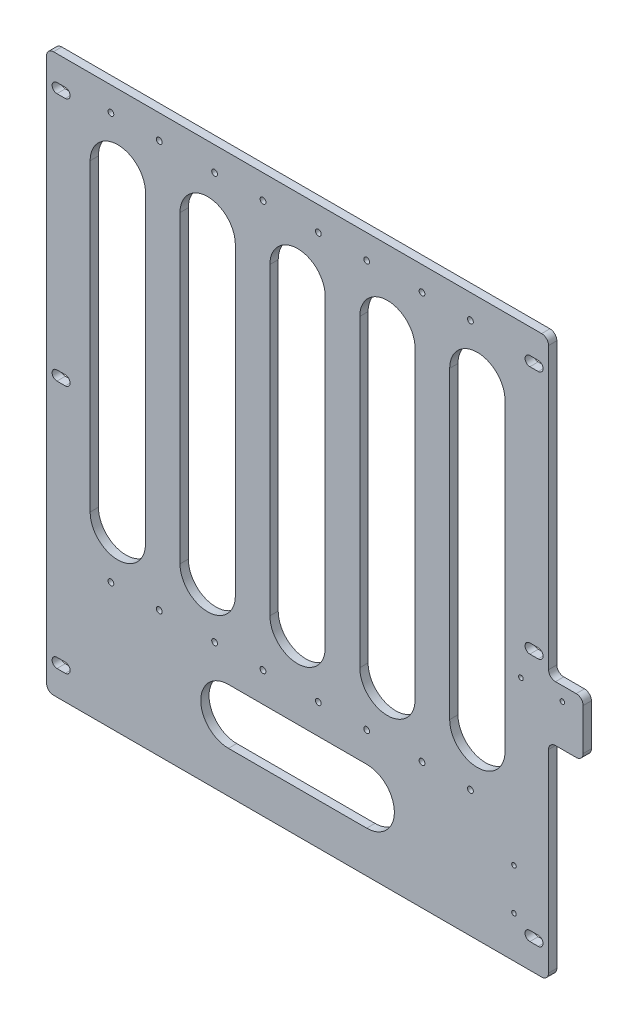
from build123d import *

# Parameters (mm, degrees)
SKETCH_1_W             = 363
SKETCH_1_H             = 403
EXTRUDE_1_DEPTH        = 6
FILLET_1_R             = 5
SKETCH_3_R             = 3.5
CUT_EXTRUDE_2_DEPTH    = 10
HOLE_WIZARD_M5_1_D     = 4.2
HOLE_WIZARD_M5_1_DEPTH = 12.4
HOLE_WIZARD_M5_1_TIP   = 1.2618073
CUT_EXTRUDE_3_DEPTH    = 10
CUT_EXTRUDE_4_DEPTH    = 10
CUT_EXTRUDE_5_DEPTH    = 10
HOLE_WIZARD_M4_1_D     = 3.3
HOLE_WIZARD_M4_1_DEPTH = 10.1
HOLE_WIZARD_M4_1_TIP   = 0.991420021
SKETCH_11_W            = 25
SKETCH_11_H            = 40
EXTRUDE_2_DEPTH        = 6
HOLE_WIZARD_M4_2_D     = 3.3
HOLE_WIZARD_M4_2_DEPTH = 10.1
HOLE_WIZARD_M4_2_TIP   = 0.991420021
FILLET_2_R             = 5


with BuildPart() as part:
    # Sketch 1 → 凸台-拉伸1 (new body)
    with BuildSketch(Plane.XY):
        Rectangle(SKETCH_1_W, SKETCH_1_H)
    extrude(amount=EXTRUDE_1_DEPTH)

    # 圆角1
    fillet_1_edges = [part.edges().sort_by_distance(p)[0] for p in [
        (181.5, -201.5, 3),
        (-181.5, -201.5, 3),
        (-181.5, 201.5, 3),
        (181.5, 201.5, 3),
    ]]
    fillet(fillet_1_edges, radius=FILLET_1_R)

    # 草图3 → 切除-拉伸2 (cut)
    with BuildSketch(Plane.XY.offset(6)):
        with Locations((-171, -180)):
            Circle(SKETCH_3_R)
        with Locations((-171, 180)):
            Circle(SKETCH_3_R)
        with Locations((-171, 0)):
            Circle(SKETCH_3_R)
        with Locations((171, 0)):
            Circle(SKETCH_3_R)
        with Locations((171, 180)):
            Circle(SKETCH_3_R)
        with Locations((171, -180)):
            Circle(SKETCH_3_R)
    extrude(amount=-CUT_EXTRUDE_2_DEPTH, mode=Mode.SUBTRACT)

    # M5 螺纹孔1
    with Locations(Plane.XY.offset(6)):
        with Locations((-135, -110), (-100, -110), (-135, 184), (-100, 184), (-60, -110), (-25, -110), (-60, 184), (-25, 184), (15, -110), (50, -110), (15, 184), (50, 184), (90, -110), (125, -110), (90, 184), (125, 184)):
            Hole(HOLE_WIZARD_M5_1_D / 2, depth=HOLE_WIZARD_M5_1_DEPTH)
            with Locations((0, 0, -(HOLE_WIZARD_M5_1_DEPTH + HOLE_WIZARD_M5_1_TIP / 2))):  # 118° drill point
                Cone(0, HOLE_WIZARD_M5_1_D / 2, HOLE_WIZARD_M5_1_TIP, mode=Mode.SUBTRACT)

    # 草图6 → 切除-拉伸3 (cut)
    with BuildSketch(Plane.XY.offset(6)):
        with BuildLine():
            Line((-174, 183.5), (-168, 183.5))
            ThreePointArc((-168, 183.5), (-164.5, 180), (-168, 176.5))
            Line((-168, 176.5), (-174, 176.5))
            ThreePointArc((-174, 176.5), (-177.5, 180), (-174, 183.5))
        make_face()
        with BuildLine():
            Line((168, 183.5), (174, 183.5))
            ThreePointArc((174, 183.5), (177.5, 180), (174, 176.5))
            Line((174, 176.5), (168, 176.5))
            ThreePointArc((168, 176.5), (164.5, 180), (168, 183.5))
        make_face()
        with BuildLine():
            Line((168, 3.5), (174, 3.5))
            ThreePointArc((174, 3.5), (177.5, 0), (174, -3.5))
            Line((174, -3.5), (168, -3.5))
            ThreePointArc((168, -3.5), (164.5, 0), (168, 3.5))
        make_face()
        with BuildLine():
            Line((168, -176.5), (174, -176.5))
            ThreePointArc((174, -176.5), (177.5, -180), (174, -183.5))
            Line((174, -183.5), (168, -183.5))
            ThreePointArc((168, -183.5), (164.5, -180), (168, -176.5))
        make_face()
        with BuildLine():
            Line((-174, 3.5), (-168, 3.5))
            ThreePointArc((-168, 3.5), (-164.5, 0), (-168, -3.5))
            Line((-168, -3.5), (-174, -3.5))
            ThreePointArc((-174, -3.5), (-177.5, 0), (-174, 3.5))
        make_face()
        with BuildLine():
            Line((-174, -176.5), (-168, -176.5))
            ThreePointArc((-168, -176.5), (-164.5, -180), (-168, -183.5))
            Line((-168, -183.5), (-174, -183.5))
            ThreePointArc((-174, -183.5), (-177.5, -180), (-174, -176.5))
        make_face()
    extrude(amount=-CUT_EXTRUDE_3_DEPTH, mode=Mode.SUBTRACT)

    # 草图7 → 切除-拉伸4 (cut)
    with BuildSketch(Plane.XY.offset(6)):
        with BuildLine():
            Line((-50, -131.5), (50, -131.5))
            ThreePointArc((50, -131.5), (70, -151.5), (50, -171.5))
            Line((50, -171.5), (-50, -171.5))
            ThreePointArc((-50, -171.5), (-70, -151.5), (-50, -131.5))
        make_face()
    extrude(amount=-CUT_EXTRUDE_4_DEPTH, mode=Mode.SUBTRACT)

    # 草图8 → 切除-拉伸5 (cut)
    with BuildSketch(Plane.XY.offset(6)):
        with BuildLine():
            Line((20, 146.5), (20, -73.5))
            ThreePointArc((20, -73.5), (0, -93.5), (-20, -73.5))
            Line((-20, -73.5), (-20, 146.5))
            ThreePointArc((-20, 146.5), (0, 166.5), (20, 146.5))
        make_face()
        with BuildLine():
            Line((85, 146.5), (85, -73.5))
            ThreePointArc((85, -73.5), (65, -93.5), (45, -73.5))
            Line((45, -73.5), (45, 146.5))
            ThreePointArc((45, 146.5), (65, 166.5), (85, 146.5))
        make_face()
        with BuildLine():
            Line((150, 146.5), (150, -73.5))
            ThreePointArc((150, -73.5), (130, -93.5), (110, -73.5))
            Line((110, -73.5), (110, 146.5))
            ThreePointArc((110, 146.5), (130, 166.5), (150, 146.5))
        make_face()
        with BuildLine():
            Line((-150, 146.5), (-150, -73.5))
            ThreePointArc((-150, -73.5), (-130, -93.5), (-110, -73.5))
            Line((-110, -73.5), (-110, 146.5))
            ThreePointArc((-110, 146.5), (-130, 166.5), (-150, 146.5))
        make_face()
        with BuildLine():
            Line((-85, 146.5), (-85, -73.5))
            ThreePointArc((-85, -73.5), (-65, -93.5), (-45, -73.5))
            Line((-45, -73.5), (-45, 146.5))
            ThreePointArc((-45, 146.5), (-65, 166.5), (-85, 146.5))
        make_face()
    extrude(amount=-CUT_EXTRUDE_5_DEPTH, mode=Mode.SUBTRACT)

    # M4 螺纹孔1
    with Locations(Plane.XY.offset(6)):
        with Locations((156.5, -171.5), (156.5, -141.5)):
            Hole(HOLE_WIZARD_M4_1_D / 2, depth=HOLE_WIZARD_M4_1_DEPTH)
            with Locations((0, 0, -(HOLE_WIZARD_M4_1_DEPTH + HOLE_WIZARD_M4_1_TIP / 2))):  # 118° drill point
                Cone(0, HOLE_WIZARD_M4_1_D / 2, HOLE_WIZARD_M4_1_TIP, mode=Mode.SUBTRACT)

    # 草图11 → 凸台-拉伸2 (add)
    with BuildSketch(Plane.XY.offset(6)):
        with Locations((194, -31.5)):
            Rectangle(SKETCH_11_W, SKETCH_11_H)
    extrude(amount=-EXTRUDE_2_DEPTH)

    # M4 螺纹孔2
    with Locations(Plane.XY.offset(6)):
        with Locations((161.5, -21.5), (191.5, -21.5)):
            Hole(HOLE_WIZARD_M4_2_D / 2, depth=HOLE_WIZARD_M4_2_DEPTH)
            with Locations((0, 0, -(HOLE_WIZARD_M4_2_DEPTH + HOLE_WIZARD_M4_2_TIP / 2))):  # 118° drill point
                Cone(0, HOLE_WIZARD_M4_2_D / 2, HOLE_WIZARD_M4_2_TIP, mode=Mode.SUBTRACT)

    # 圆角2
    fillet_2_edges = [part.edges().sort_by_distance(p)[0] for p in [
        (181.5, -51.5, 3),
        (181.5, -11.5, 3),
        (206.5, -11.5, 3),
        (206.5, -51.5, 3),
    ]]
    fillet(fillet_2_edges, radius=FILLET_2_R)


solid = part.part
